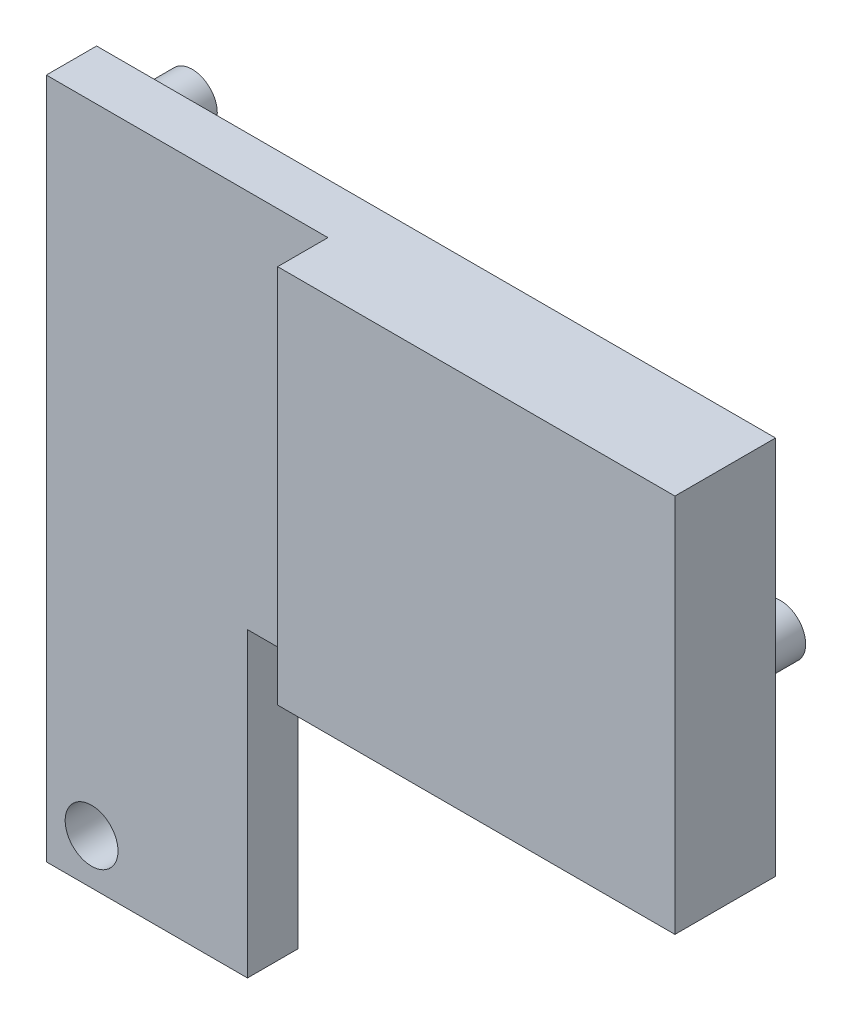
from build123d import *

# Parameters (mm, degrees)
SKETCH1_R           = 1.05
BOSS_EXTRUDE1_DEPTH = 2
SKETCH2_R           = 1
BOSS_EXTRUDE2_DEPTH = 4
SKETCH3_W           = 15.8
SKETCH3_H           = 15.3
BOSS_EXTRUDE3_DEPTH = 2
SKETCH4_W           = 27
SKETCH4_H           = 0.2
CUT_EXTRUDE1_DEPTH  = 79.597789409


with BuildPart() as part:
    # Sketch1 → Boss-Extrude1 (new body)
    with BuildSketch(Plane.XY):
        Polygon((-53.65, -57.3), (-45.65, -57.3), (-45.65, -45.3), (-26.65, -45.3), (-26.65, -30), (-53.65, -30), align=None)
        with Locations((-51.85, -55.5)):
            Circle(SKETCH1_R, mode=Mode.SUBTRACT)
    extrude(amount=BOSS_EXTRUDE1_DEPTH)

    # Sketch2 → Boss-Extrude2 (add)
    with BuildSketch(Plane.XY.offset(2)):
        with Locations((-28.45, -38.7)):
            Circle(SKETCH2_R)
        with Locations((-51.85, -32.1)):
            Circle(SKETCH2_R)
    extrude(amount=-BOSS_EXTRUDE2_DEPTH)

    # Sketch3 → Boss-Extrude3 (add)
    with BuildSketch(Plane.XY.offset(2)):
        with Locations((-34.55, -37.65)):
            Rectangle(SKETCH3_W, SKETCH3_H)
    extrude(amount=BOSS_EXTRUDE3_DEPTH)

    # Sketch4 → Cut-Extrude1 (cut, through all)
    with BuildSketch(Plane(origin=(0, 0, 0), x_dir=(-1, 0, 0), z_dir=(0, 0, -1))):
        with Locations((40.15, -30.1)):
            Rectangle(SKETCH4_W, SKETCH4_H)
    extrude(amount=-CUT_EXTRUDE1_DEPTH, mode=Mode.SUBTRACT)


solid = part.part
